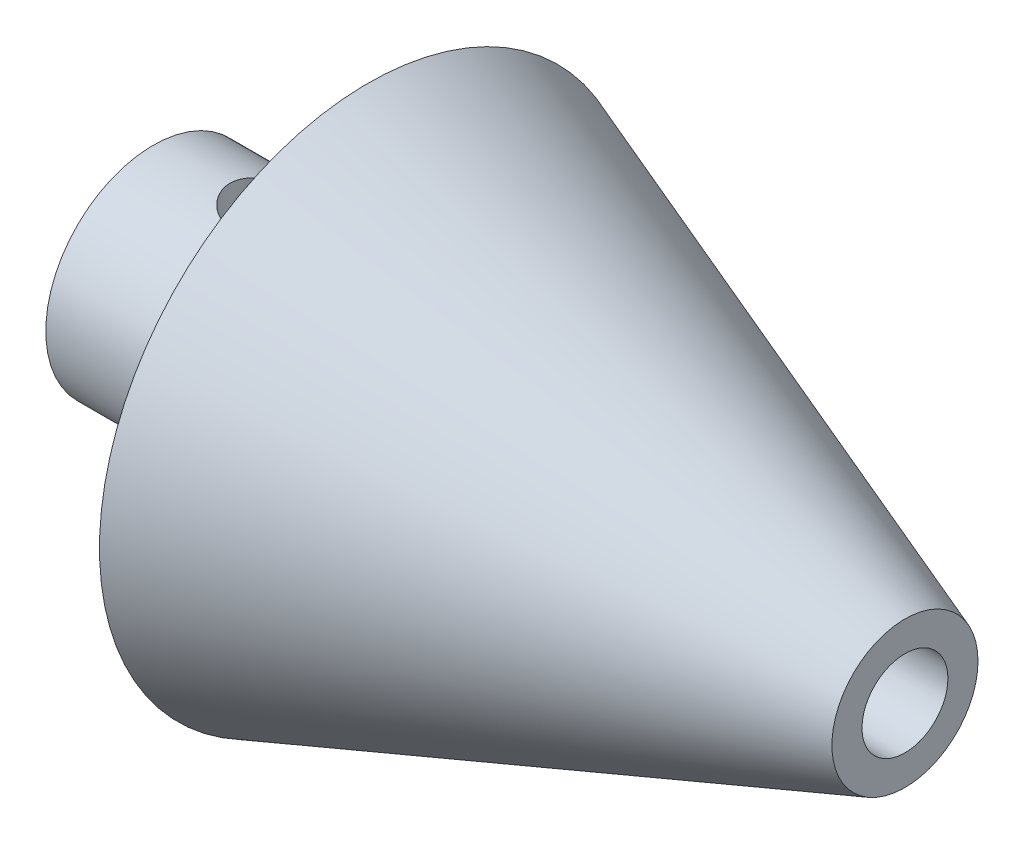
from build123d import *

# Parameters (mm, degrees)
CROQUIS1_R                         = 10
SALIENTE_EXTRUIR1_DEPTH            = 20
CROQUIS2_R                         = 25
SALIENTE_EXTRUIR2_DEPTH            = 50
SALIENTE_EXTRUIR2_TAPER            = 20
CROQUIS3_R                         = 4
CORTAR_EXTRUIR2_DEPTH              = 70
TALADRO_DE_MARGEN_PARA_1_41_REACH  = 76.055
TALADRO_DE_MARGEN_PARA_1_41_BORE_R = 3.3782


with BuildPart() as part:
    # Croquis1 → Saliente-Extruir1 (new body)
    with BuildSketch(Plane(origin=(0, 0, 0), x_dir=(0, 0, -1), z_dir=(1, 0, 0))):
        Circle(CROQUIS1_R)
    extrude(amount=SALIENTE_EXTRUIR1_DEPTH)

    # Croquis2 → Saliente-Extruir2 (add)
    with BuildSketch(Plane(origin=(20, 0, 0), x_dir=(0, 0, -1), z_dir=(1, 0, 0))):
        Circle(CROQUIS2_R)
    extrude(amount=SALIENTE_EXTRUIR2_DEPTH, taper=SALIENTE_EXTRUIR2_TAPER)

    # Croquis3 → Cortar-Extruir2 (cut)
    with BuildSketch(Plane(origin=(70, 0, 0), x_dir=(0, 0, -1), z_dir=(1, 0, 0))):
        Circle(CROQUIS3_R)
    extrude(amount=-CORTAR_EXTRUIR2_DEPTH, mode=Mode.SUBTRACT)

    # Taladro de margen para 1/41 bore (on position points) → Taladro de margen para 1/41 (cut, up to next)
    with BuildSketch(Plane(origin=(10, 9.974931901, -0.707625302), x_dir=(0, 0.070762530204, 0.997493190112), z_dir=(0, 0.997493190112, -0.070762530204)), mode=Mode.PRIVATE) as taladro_de_margen_para_1_41_sk1:
        Circle(TALADRO_DE_MARGEN_PARA_1_41_BORE_R)
    taladro_de_margen_para_1_41_tool1 = extrude(taladro_de_margen_para_1_41_sk1.sketch, amount=-TALADRO_DE_MARGEN_PARA_1_41_REACH, mode=Mode.PRIVATE) & part.part
    add(taladro_de_margen_para_1_41_tool1.solids().sort_by_distance((10, 9.974932, -0.707625))[0], mode=Mode.SUBTRACT)


solid = part.part
